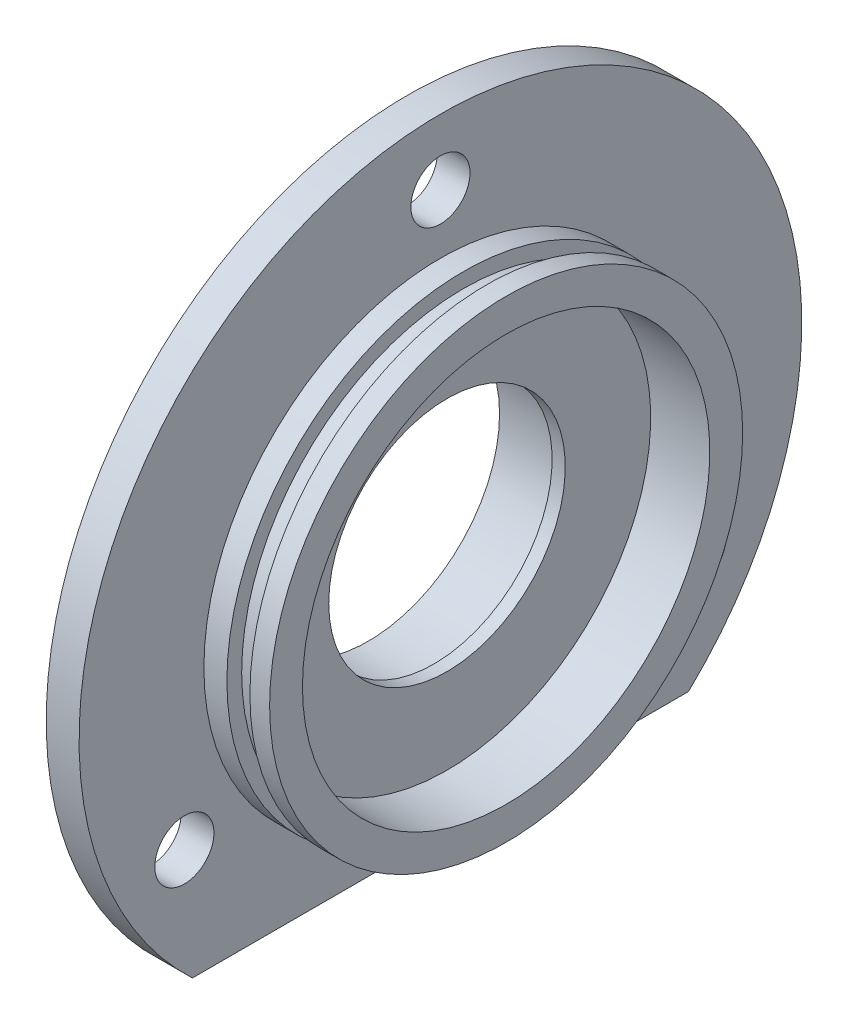
from build123d import *

# Parameters (mm, degrees)
SCHIZZO2_R               = 4.5
TAGLIO_ESTRUSIONE1_DEPTH = 94.653617122
SCHIZZO3_W               = 75.498344352
SCHIZZO3_H               = 30
TAGLIO_ESTRUSIONE2_DEPTH = 95.207218407


with BuildPart() as part:
    # Schizzo1 → Rivoluzione1 (revolve)
    with BuildSketch(Plane.XY):
        Polygon((0, 0), (0, 5), (6, 5), (6, 35), (11, 35), (11, 16), (14.5, 16), (14.5, 13.75), (18, 13.75), (18, 16), (21, 16), (21, 11), (12, 11), (12, -2), (10, -2), (10, 0), align=None)
    revolve(axis=Axis((-8.306759574, -20, 0), (1, 0, 0)))

    # Schizzo2 → Taglio-Estrusione1 (cut, through all)
    with BuildSketch(Plane(origin=(11, 0, 0), x_dir=(0, 0, -1), z_dir=(1, 0, 0))):
        with Locations((0, 25)):
            Circle(SCHIZZO2_R)
        with Locations((88.334591186, -128)):
            Circle(SCHIZZO2_R)
        with Locations((-88.334591186, -128)):
            Circle(SCHIZZO2_R)
        with Locations((38.97114317, -42.5)):
            Circle(SCHIZZO2_R)
        with Locations((-38.97114317, -42.5)):
            Circle(SCHIZZO2_R)
    extrude(amount=-TAGLIO_ESTRUSIONE1_DEPTH, mode=Mode.SUBTRACT)

    # Schizzo3 → Taglio-Estrusione2 (cut, through all)
    with BuildSketch(Plane.ZY.offset(-6)):
        with Locations((0, -75)):
            Rectangle(SCHIZZO3_W, SCHIZZO3_H)
    extrude(amount=-TAGLIO_ESTRUSIONE2_DEPTH, mode=Mode.SUBTRACT)


solid = part.part
